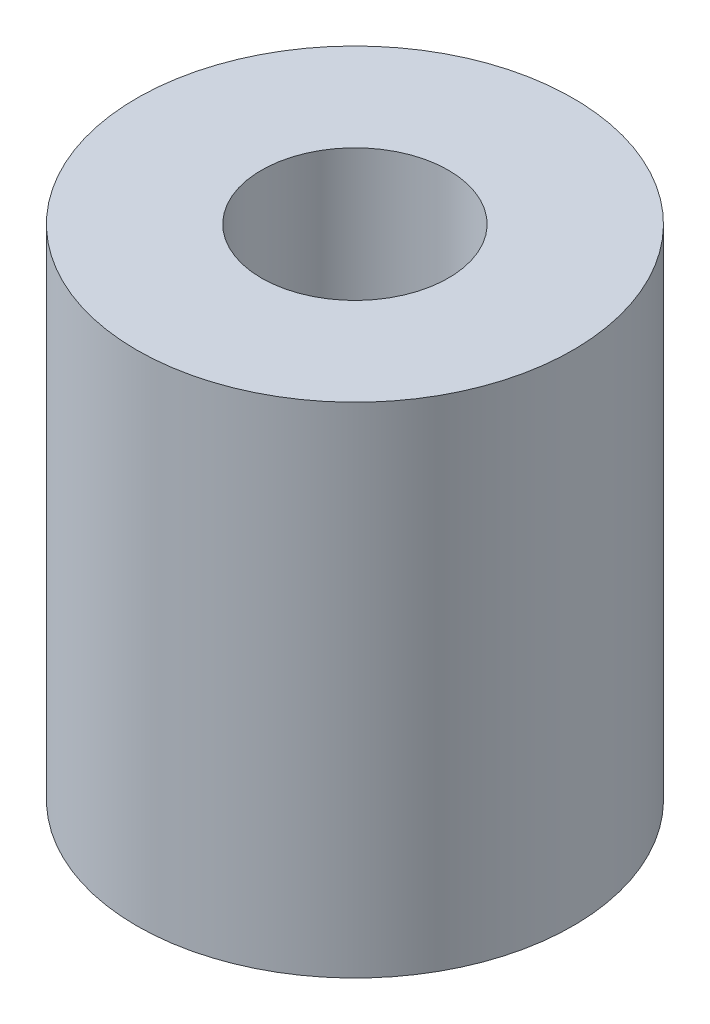
from build123d import *

# Parameters (mm, degrees)
CROQUIS_BASE_R          = 3.5
SALIENTE_EXTRUIR1_DEPTH = 8
CROQUIS_BARRENO_R       = 1.5
CORTAR_EXTRUIR1_DEPTH   = 8


with BuildPart() as part:
    # Croquis base → Saliente-Extruir1 (new body)
    with BuildSketch(Plane(origin=(0, 0, 0), x_dir=(1, 0, 0), z_dir=(0, 1, 0))):
        with Locations(Location((0, 0, 0), (0, 0, 270))):
            Circle(CROQUIS_BASE_R)
    extrude(amount=SALIENTE_EXTRUIR1_DEPTH)

    # Croquis barreno → Cortar-Extruir1 (cut)
    with BuildSketch(Plane(origin=(0, 8, 0), x_dir=(1, 0, 0), z_dir=(0, 1, 0))):
        with Locations(Location((0, 0, 0), (0, 0, 270))):
            Circle(CROQUIS_BARRENO_R)
    extrude(amount=-CORTAR_EXTRUIR1_DEPTH, mode=Mode.SUBTRACT)


solid = part.part
